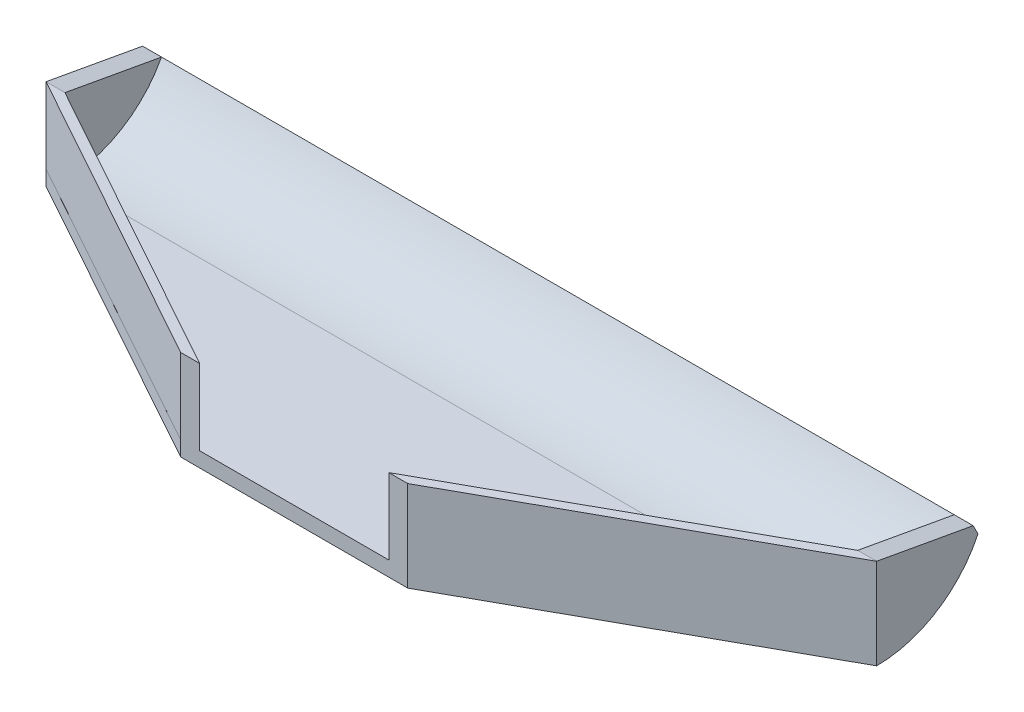
from build123d import *

# Parameters (mm, degrees)
BOSS_EXTRUDE1_DEPTH = 1317.1
CUT_EXTRUDE3_DEPTH  = 1388.288687357
BOSS_EXTRUDE5_DEPTH = 120
BOSS_EXTRUDE6_DEPTH = 30
BOSS_EXTRUDE7_START = -30
BOSS_EXTRUDE7_DEPTH = 30


with BuildPart() as part:
    # Sketch4 → Boss-Extrude1 (new body)
    with BuildSketch(Plane(origin=(0, 0, 0), x_dir=(0, 0, -1), z_dir=(1, 0, 0))):
        with BuildLine():
            Line((-159.891789037, -100.950379886), (-425.791789037, -100.950379886))
            Line((-425.791789037, -100.950379886), (-425.791789037, -77.297586412))
            Line((-425.791789037, -77.297586412), (-160.824878808, -77.297586412))
            ThreePointArc((-160.824878808, -77.297586412), (-71.405126121, -52.440077817), (-7.642881742, 15))
            Line((-7.642881742, 15), (0, 0))
            ThreePointArc((0, 0), (-65.345023624, -73.601000579), (-159.891789037, -100.950379886))
        make_face()
    extrude(amount=BOSS_EXTRUDE1_DEPTH)

    # Sketch10 → Cut-Extrude3 (cut, through all)
    with BuildSketch(Plane(origin=(0, -77.297586412, 0), x_dir=(1, 0, 0), z_dir=(0, 1, 0))):
        Polygon((0, -425.791789037), (478.6, -425.791789037), (0, -160.824878808), align=None)
        Polygon((1317.1, -160.824878808), (838.6, -425.791789037), (1317.1, -425.791789037), align=None)
    extrude(amount=-CUT_EXTRUDE3_DEPTH, mode=Mode.SUBTRACT)

    # Sketch11 → Boss-Extrude5 (add)
    with BuildSketch(Plane(origin=(0, -77.297586412, 0), x_dir=(1, 0, 0), z_dir=(0, 1, 0))):
        Polygon((838.6, -425.791789037), (808.6, -425.791789037), (1287.1, -160.824878808), (1317.1, -160.824878808), align=None)
        Polygon((478.6, -425.791789037), (508.6, -425.791789037), (30.1, -160.824878808), (0.1, -160.824878808), align=None)
    extrude(amount=BOSS_EXTRUDE5_DEPTH)

    # Sketch13 → Boss-Extrude6 (add)
    with BuildSketch(Plane(origin=(0, 0, 0), x_dir=(0, 0, -1), z_dir=(1, 0, 0))):
        with BuildLine():
            Line((-7.642881742, 15), (-160.824878808, 42.702413588))
            Line((-160.824878808, 42.702413588), (-160.824878808, -77.297586412))
            ThreePointArc((-160.824878808, -77.297586412), (-71.405126121, -52.440077817), (-7.642881742, 15))
        make_face()
    extrude(amount=BOSS_EXTRUDE6_DEPTH)

    # Sketch12 → Boss-Extrude7 (add)
    with BuildSketch(Plane(origin=(1317.1, 0, 0), x_dir=(0, 0, -1), z_dir=(1, 0, 0)).offset(BOSS_EXTRUDE7_START)):
        with BuildLine():
            Line((-7.642881742, 15), (-160.824878808, 42.702413588))
            Line((-160.824878808, 42.702413588), (-160.824878808, -77.297586412))
            ThreePointArc((-160.824878808, -77.297586412), (-71.405126121, -52.440077817), (-7.642881742, 15))
        make_face()
    extrude(amount=BOSS_EXTRUDE7_DEPTH)


solid = part.part
